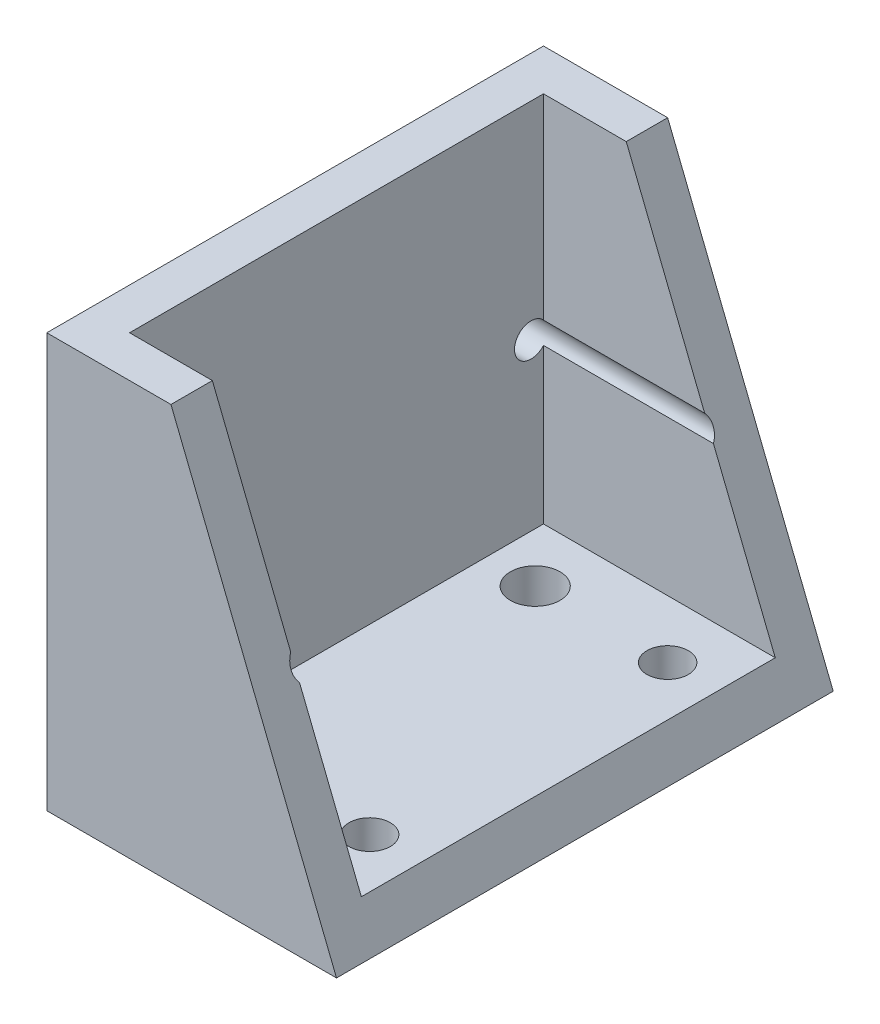
from build123d import *

# Parameters (mm, degrees)
EXTRUDE_1_DEPTH     = 60
SKETCH_2_W          = 34.498052415
SKETCH_2_H          = 50
CUT_EXTRUDE_1_DEPTH = 45
SKETCH_3_R          = 3
SKETCH_3_R_2        = 2.5
CUT_EXTRUDE_2_DEPTH = 91.816454432
SKETCH_6_R          = 2
CUT_EXTRUDE_3_DEPTH = 82.627431502


with BuildPart() as part:
    # 草图1 → 凸台-拉伸1 (new body)
    with BuildSketch(Plane.XY):
        Polygon((-11.342511753, -7.127659574), (-46.342511753, -7.127659574), (-46.342511753, 42.872340426), (-31.342511753, 42.872340426), align=None)
    extrude(amount=EXTRUDE_1_DEPTH)

    # 草图2 → 切除-拉伸1 (cut)
    with BuildSketch(Plane(origin=(0, 42.872340426, 0), x_dir=(1, 0, 0), z_dir=(0, 1, 0))):
        with Locations((-24.093485546, -30)):
            Rectangle(SKETCH_2_W, SKETCH_2_H)
    extrude(amount=-CUT_EXTRUDE_1_DEPTH, mode=Mode.SUBTRACT)

    # 草图3 → 切除-拉伸2 (cut, through all)
    with BuildSketch(Plane.XZ.offset(7.127659574)):
        with Locations((-35.342511753, 48)):
            Circle(SKETCH_3_R)
        with Locations(Location((-35.342511753, 12, 0), (0, 0, 270))):
            Circle(SKETCH_3_R)
        with Locations(Location((-19.342511753, 12, 0), (0, 0, 270))):
            Circle(SKETCH_3_R_2)
        with Locations((-19.342511753, 48)):
            Circle(SKETCH_3_R_2)
    extrude(amount=-CUT_EXTRUDE_2_DEPTH, mode=Mode.SUBTRACT)

    # 草图6 → 切除-拉伸3 (cut, through all)
    with BuildSketch(Plane.ZY.offset(46.342511753)):
        with Locations((53.5, 17.872340426)):
            Circle(SKETCH_6_R)
        with Locations(Location((6.5, 17.872340426, 0), (0, 0, 221.409622109))):
            Circle(SKETCH_6_R)
    extrude(amount=-CUT_EXTRUDE_3_DEPTH, mode=Mode.SUBTRACT)


solid = part.part
